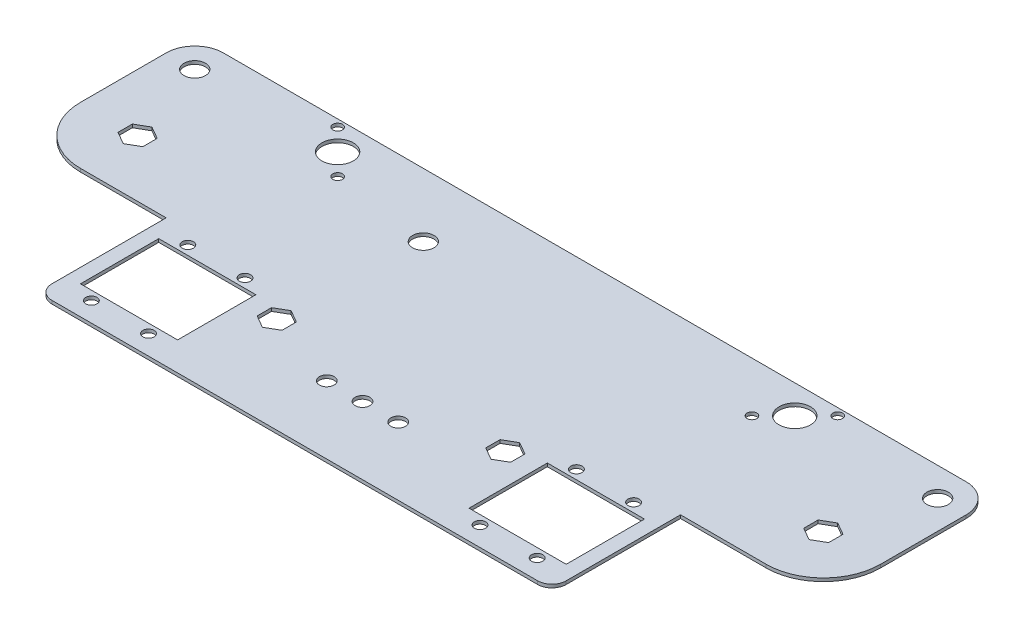
from build123d import *

# Parameters (mm, degrees)
SKETCH1_R           = 2.5
SKETCH1_R_2         = 3.2639
SKETCH1_R_3         = 6.985
SKETCH1_R_4         = 2.159
SKETCH1_R_5         = 4.7625
SKETCH1_W           = 43.18
SKETCH1_H           = 34.798
BOSS_EXTRUDE1_DEPTH = 1.4478


with BuildPart() as part:
    # Sketch1 → Boss-Extrude1 (new body)
    with BuildSketch(Plane(origin=(0, 0, 0), x_dir=(1, 0, 0), z_dir=(0, 1, 0))):
        with BuildLine():
            Line((-58.048540962, -286.823205678), (-96.148540962, -286.823205678))
            ThreePointArc((-96.148540962, -286.823205678), (-114.109053204, -279.38371792), (-121.548540962, -261.423205678))
            Line((-121.548540962, -261.423205678), (-121.548540962, -223.323205678))
            ThreePointArc((-121.548540962, -223.323205678), (-117.828797083, -214.342949557), (-108.848540962, -210.623205678))
            Line((-108.848540962, -210.623205678), (221.351459038, -210.623205678))
            ThreePointArc((221.351459038, -210.623205678), (230.331715159, -214.342949557), (234.051459038, -223.323205678))
            Line((234.051459038, -223.323205678), (234.051459038, -261.423205678))
            ThreePointArc((234.051459038, -261.423205678), (226.611971281, -279.38371792), (208.651459038, -286.823205678))
            Line((208.651459038, -286.823205678), (170.551459038, -286.823205678))
            Line((170.551459038, -286.823205678), (170.551459038, -337.623205678))
            ThreePointArc((170.551459038, -337.623205678), (168.691587099, -342.113333738), (164.201459038, -343.973205678))
            Line((164.201459038, -343.973205678), (-51.698540962, -343.973205678))
            ThreePointArc((-51.698540962, -343.973205678), (-56.188669022, -342.113333738), (-58.048540962, -337.623205678))
            Line((-58.048540962, -337.623205678), (-58.048540962, -286.823205678))
        make_face()
        with Locations(Location((-42.808540962, -292.442955678, 0), (0, 0, 270))):
            Circle(SKETCH1_R, mode=Mode.SUBTRACT)
        with Locations(Location((-17.408540962, -292.442955678, 0), (0, 0, 90))):
            Circle(SKETCH1_R, mode=Mode.SUBTRACT)
        with Locations(Location((-17.408540962, -335.305455678, 0), (0, 0, 270))):
            Circle(SKETCH1_R, mode=Mode.SUBTRACT)
        with Locations(Location((-42.808540962, -335.305455678, 0), (0, 0, 90))):
            Circle(SKETCH1_R, mode=Mode.SUBTRACT)
        with Locations(Location((129.911459038, -292.442955678, 0), (0, 0, 270))):
            Circle(SKETCH1_R, mode=Mode.SUBTRACT)
        with Locations(Location((155.311459038, -292.442955678, 0), (0, 0, 90))):
            Circle(SKETCH1_R, mode=Mode.SUBTRACT)
        with Locations(Location((155.311459038, -335.305455678, 0), (0, 0, 270))):
            Circle(SKETCH1_R, mode=Mode.SUBTRACT)
        with Locations(Location((129.911459038, -335.305455678, 0), (0, 0, 90))):
            Circle(SKETCH1_R, mode=Mode.SUBTRACT)
        with Locations(Location((40.376459038, -313.874205678, 0), (0, 0, 270))):
            Circle(SKETCH1_R_2, mode=Mode.SUBTRACT)
        with Locations(Location((56.251459038, -313.874205678, 0), (0, 0, 270))):
            Circle(SKETCH1_R_2, mode=Mode.SUBTRACT)
        with Locations(Location((72.126459038, -313.874205678, 0), (0, 0, 270))):
            Circle(SKETCH1_R_2, mode=Mode.SUBTRACT)
        with Locations(Location((-45.348540962, -223.323205678, 0), (0, 0, 270))):
            Circle(SKETCH1_R_3, mode=Mode.SUBTRACT)
        with Locations(Location((-54.873540962, -213.798205678, 0), (0, 0, 270))):
            Circle(SKETCH1_R_4, mode=Mode.SUBTRACT)
        with Locations(Location((-35.823540962, -232.848205678, 0), (0, 0, 270))):
            Circle(SKETCH1_R_4, mode=Mode.SUBTRACT)
        with Locations(Location((8.245459038, -238.817205678, 0), (0, 0, 270))):
            Circle(SKETCH1_R_5, mode=Mode.SUBTRACT)
        with Locations(Location((148.326459038, -232.848205678, 0), (0, 0, 90))):
            Circle(SKETCH1_R_4, mode=Mode.SUBTRACT)
        with Locations(Location((157.851459038, -223.323205678, 0), (0, 0, 90))):
            Circle(SKETCH1_R_3, mode=Mode.SUBTRACT)
        with Locations(Location((167.376459038, -213.798205678, 0), (0, 0, 90))):
            Circle(SKETCH1_R_4, mode=Mode.SUBTRACT)
        with Locations(Location((-108.848540962, -223.323205678, 0), (0, 0, 270))):
            Circle(SKETCH1_R_5, mode=Mode.SUBTRACT)
        with Locations(Location((221.351459038, -223.323205678, 0), (0, 0, 270))):
            Circle(SKETCH1_R_5, mode=Mode.SUBTRACT)
        with Locations((-30.108540962, -313.874205678)):
            Rectangle(SKETCH1_W, SKETCH1_H, mode=Mode.SUBTRACT)
        with Locations((142.611459038, -313.874205678)):
            Rectangle(SKETCH1_W, SKETCH1_H, mode=Mode.SUBTRACT)
        Polygon((10.975959038, -304.36377724), (10.975959038, -297.984634115), (5.451459038, -294.795062553), (-0.073040962, -297.984634115), (-0.073040962, -304.36377724), (5.451459038, -307.553348802), align=None, mode=Mode.SUBTRACT)
        Polygon((107.051459038, -307.553348802), (101.526959038, -304.36377724), (101.526959038, -297.984634115), (107.051459038, -294.795062553), (112.575959038, -297.984634115), (112.575959038, -304.36377724), align=None, mode=Mode.SUBTRACT)
        Polygon((-90.624040962, -258.233634115), (-96.148540962, -255.044062553), (-101.673040962, -258.233634115), (-101.673040962, -264.61277724), (-96.148540962, -267.802348802), (-90.624040962, -264.61277724), align=None, mode=Mode.SUBTRACT)
        Polygon((214.175959038, -264.61277724), (208.651459038, -267.802348802), (203.126959038, -264.61277724), (203.126959038, -258.233634115), (208.651459038, -255.044062553), (214.175959038, -258.233634115), align=None, mode=Mode.SUBTRACT)
    extrude(amount=BOSS_EXTRUDE1_DEPTH)


solid = part.part
